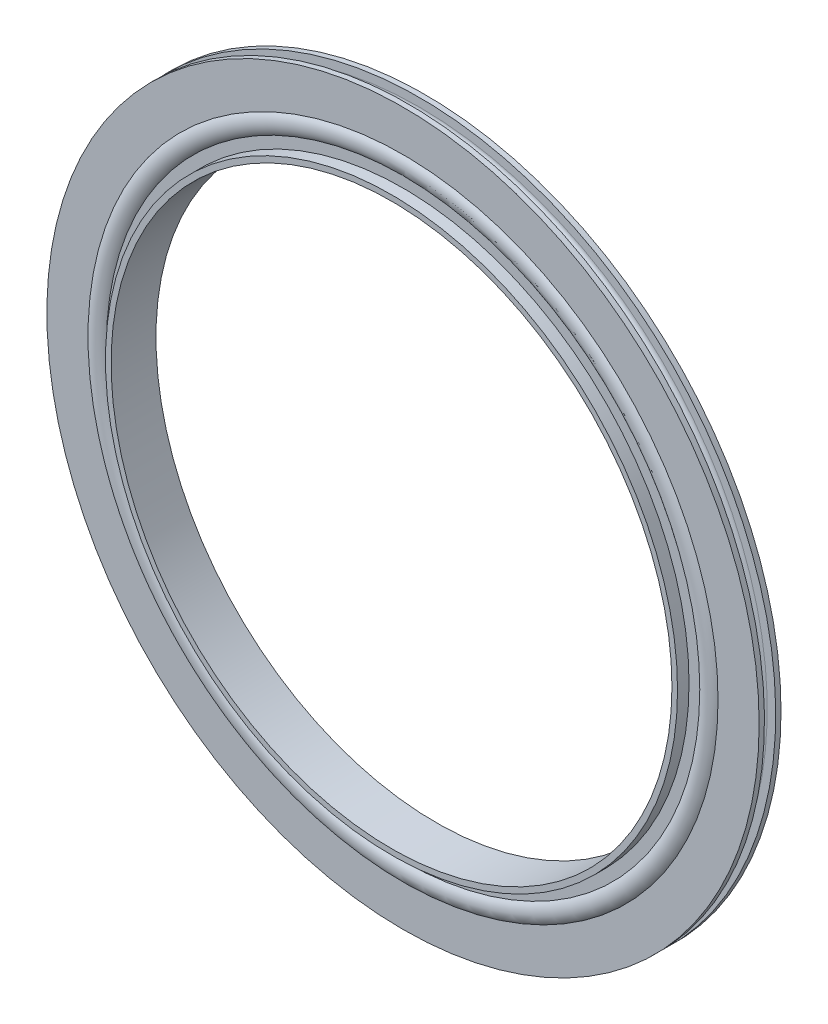
from build123d import *

# Parameters (mm, degrees)
SKETCH1_R      = 63.5
EXTRUDE1_DEPTH = 1.95
SKETCH2_R      = 51
EXTRUDE2_DEPTH = 4
SKETCH3_R      = 50
EXTRUDE3_DEPTH = 91.158194303
SKETCH5_R      = 2.54


with BuildPart() as part:
    # Sketch1 → Extrude1 (new, symmetric)
    with BuildSketch(Plane.XY):
        Circle(SKETCH1_R)
    extrude(amount=EXTRUDE1_DEPTH, both=True)

    # Sketch2 → Extrude2 (add, symmetric)
    with BuildSketch(Plane.XY):
        Circle(SKETCH2_R)
    extrude(amount=EXTRUDE2_DEPTH, both=True)

    # Sketch3 → Extrude3 (cut, through all)
    with BuildSketch(Plane.XY.offset(4)):
        Circle(SKETCH3_R)
    extrude(amount=-EXTRUDE3_DEPTH, mode=Mode.SUBTRACT)

    # Sketch5 → Revolve2 (revolve)
    with BuildSketch(Plane(origin=(0, 0, 0), x_dir=(0, 0, -1), z_dir=(1, 0, 0)), mode=Mode.PRIVATE) as revolve2_sk:
        with Locations((0, 54.54)):
            Circle(SKETCH5_R)
    revolve(revolve2_sk.sketch.rotate(Axis((0, 0, 4), (0, 0, -1)), 90), axis=Axis((0, 0, 4), (0, 0, -1)))

    # Sketch6 → Cut-Revolve1 (revolve, cut)
    with BuildSketch(Plane(origin=(0, 0, 0), x_dir=(0, 0, -1), z_dir=(1, 0, 0)), mode=Mode.PRIVATE) as cut_revolve1_sk:
        with BuildLine():
            Line((-1, 63.5), (-1, 62))
            ThreePointArc((-1, 62), (0, 61), (1, 62))
            Line((1, 62), (1, 63.5))
            Line((1, 63.5), (-1, 63.5))
        make_face()
    revolve(cut_revolve1_sk.sketch.rotate(Axis((0, 0, 4), (0, 0, -1)), 180), axis=Axis((0, 0, 4), (0, 0, -1)), mode=Mode.SUBTRACT)


solid = part.part
